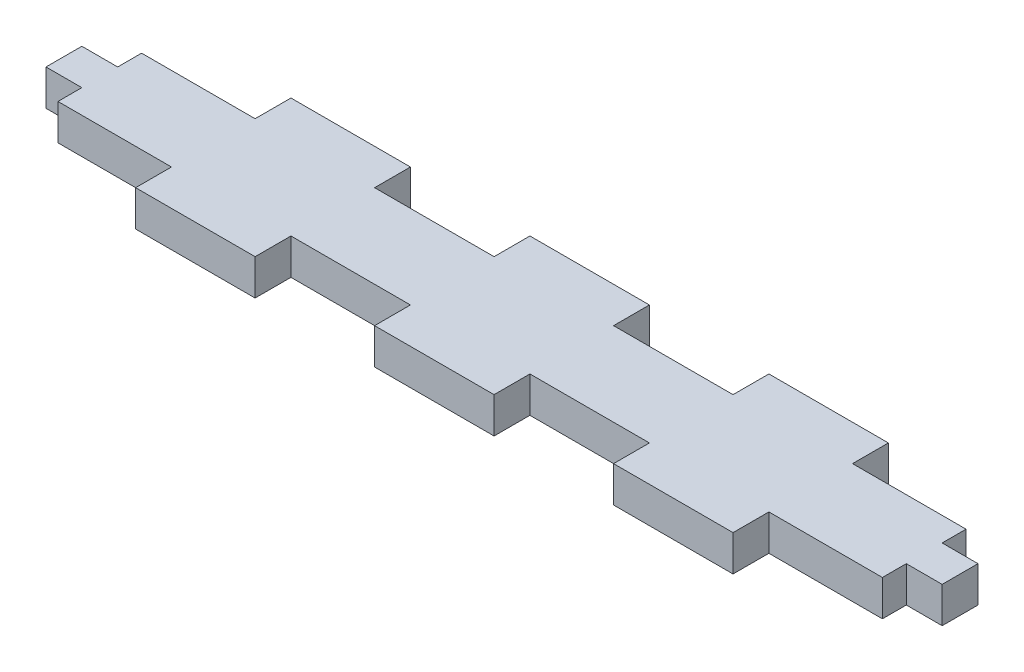
from build123d import *

# Parameters (mm, degrees)
SALIENTE_EXTRUIR1_DEPTH = 3


with BuildPart() as part:
    # Croquis1 → Saliente-Extruir1 (new body)
    with BuildSketch(Plane(origin=(0, 0, 0), x_dir=(1, 0, 0), z_dir=(0, 1, 0))):
        Polygon((12.5, 3), (12.5, 0), (22.5, 0), (22.5, 3), (32.5, 3), (32.5, 0), (42.5, 0), (42.5, 3), (52.5, 3), (52.5, 0), (62.5, 0), (62.5, 3), (72, 3), (72, 5), (75, 5), (75, 8), (72, 8), (72, 10), (62.5, 10), (62.5, 13), (52.5, 13), (52.5, 10), (42.5, 10), (42.5, 13), (37.5, 13), (32.5, 13), (32.5, 10), (22.5, 10), (22.5, 13), (12.5, 13), (12.5, 10), (3, 10), (3, 8), (0, 8), (0, 6.5), (0, 5), (3, 5), (3, 3), align=None)
    extrude(amount=SALIENTE_EXTRUIR1_DEPTH)


solid = part.part
